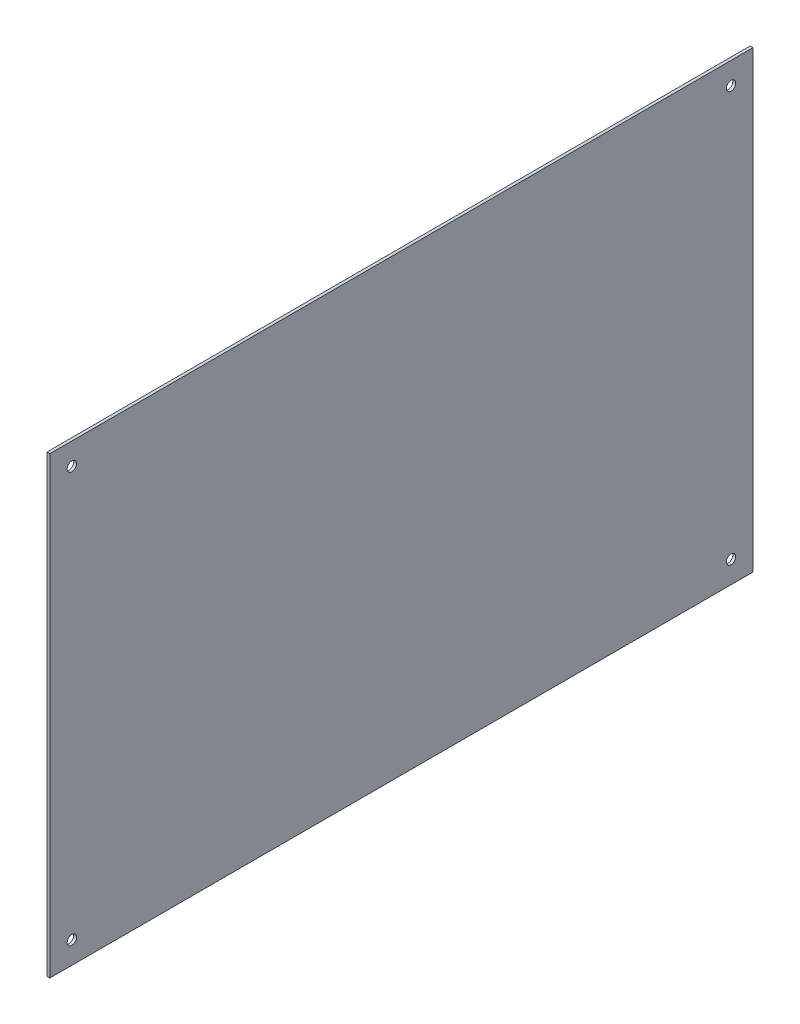
from build123d import *

# Parameters (mm, degrees)
SKETCH_2_W      = 240
SKETCH_2_H      = 155
SKETCH_2_R      = 1.6
EXTRUDE_1_DEPTH = 1


with BuildPart() as part:
    # ｽｹｯﾁ2 → ﾎﾞｽ - 押し出し1 (new body)
    with BuildSketch(Plane(origin=(0, 0, 0), x_dir=(0, 0, -1), z_dir=(1, 0, 0))):
        Rectangle(SKETCH_2_W, SKETCH_2_H)
        with Locations((-112.5, 70)):
            Circle(SKETCH_2_R, mode=Mode.SUBTRACT)
        with Locations((-112.5, -70)):
            Circle(SKETCH_2_R, mode=Mode.SUBTRACT)
        with Locations((112.5, -70)):
            Circle(SKETCH_2_R, mode=Mode.SUBTRACT)
        with Locations((112.5, 70)):
            Circle(SKETCH_2_R, mode=Mode.SUBTRACT)
    extrude(amount=EXTRUDE_1_DEPTH)


solid = part.part
